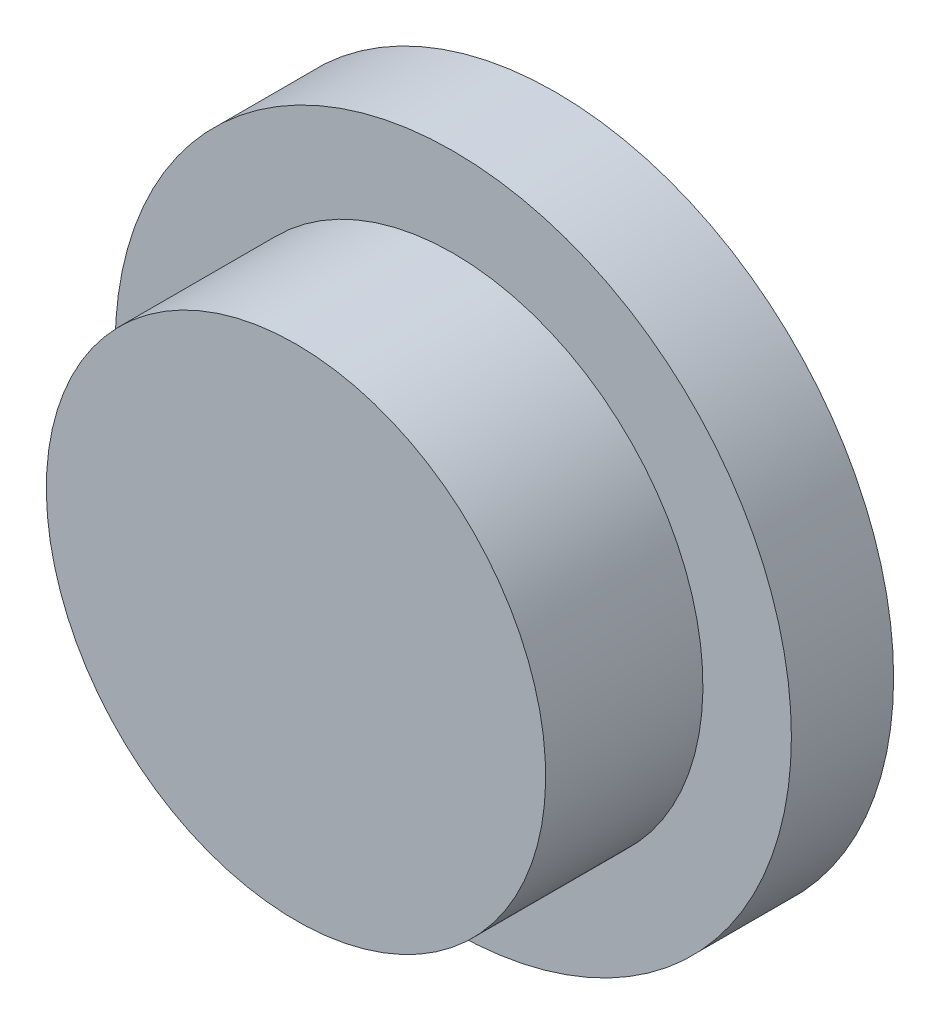
from build123d import *


with BuildPart() as part:
    # Эскиз1 → Повернуть1 (revolve)
    with BuildSketch(Plane(origin=(0, 0, 0), x_dir=(0, 0, -1), z_dir=(1, 0, 0))):
        Polygon((6, 0), (0, 0), (0, 31.75), (20, 31.75), (20, 43), (33, 43), (33, 40), (27, 40), (27, 37), (30, 37), (30, 27), (3, 19), (3, 14), (6, 14), align=None)
    revolve(axis=Axis((0, 0, -6), (0, 0, 1)))


solid = part.part
